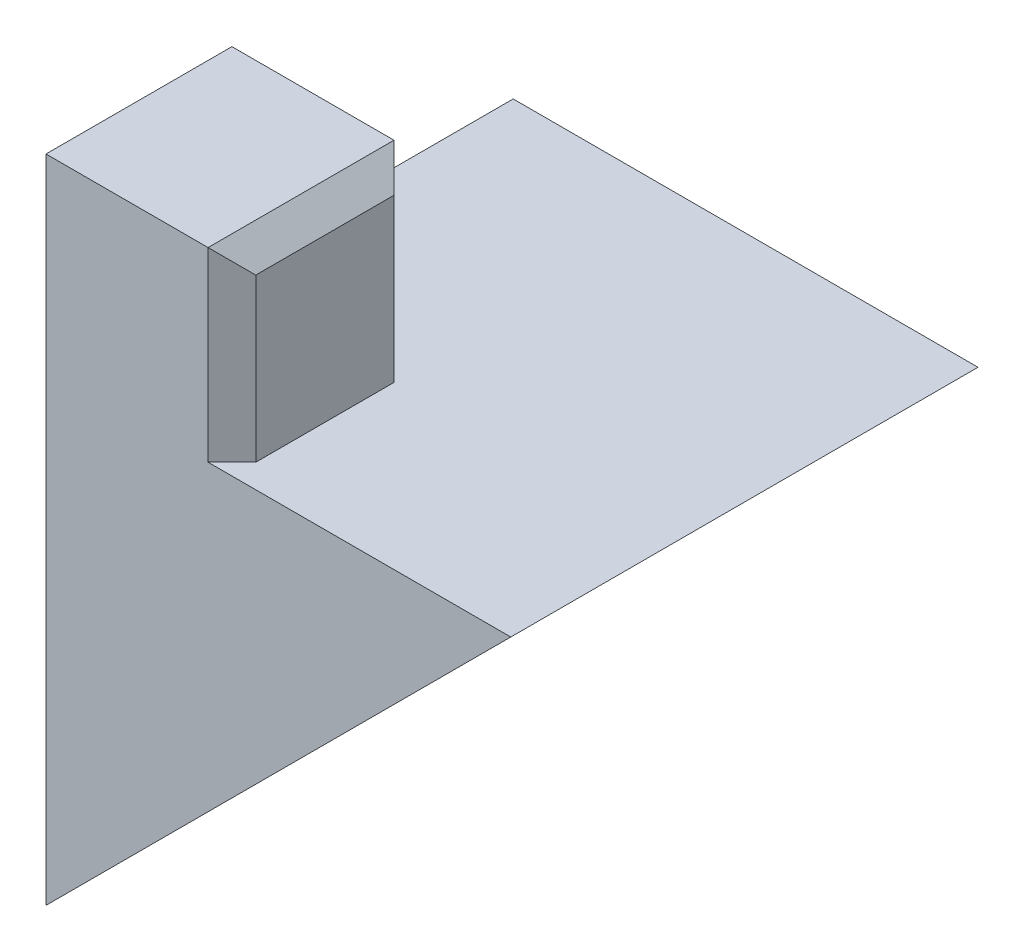
from build123d import *

# Parameters (mm, degrees)
BOSS_EXTRUDE1_DEPTH = 19.6
BOSS_EXTRUDE5_DEPTH = 7.8
CHAMFER4_SIZE       = 1


with BuildPart() as part:
    # Sketch1 → Boss-Extrude1 (new body)
    with BuildSketch(Plane.XY):
        Polygon((0, 0), (0, -19.5), (19.5, 0), align=None)
    extrude(amount=-BOSS_EXTRUDE1_DEPTH)

    # Sketch2 → Boss-Extrude5 (add)
    with BuildSketch(Plane(origin=(0, 0, 0), x_dir=(1, 0, 0), z_dir=(0, 1, 0))):
        Polygon((7.8, 7.8), (0, 7.8), (0, 5.9), (0, 0), (7.8, 0), align=None)
    extrude(amount=BOSS_EXTRUDE5_DEPTH)

    # Chamfer4
    chamfer4_edges = [part.edges().sort_by_distance(p)[0] for p in [
        (7.8, 7.8, -3.9),
        (7.8, 3.9, 0),
        (7.8, 3.9, -7.8),
    ]]
    chamfer(chamfer4_edges, length=CHAMFER4_SIZE)


solid = part.part
